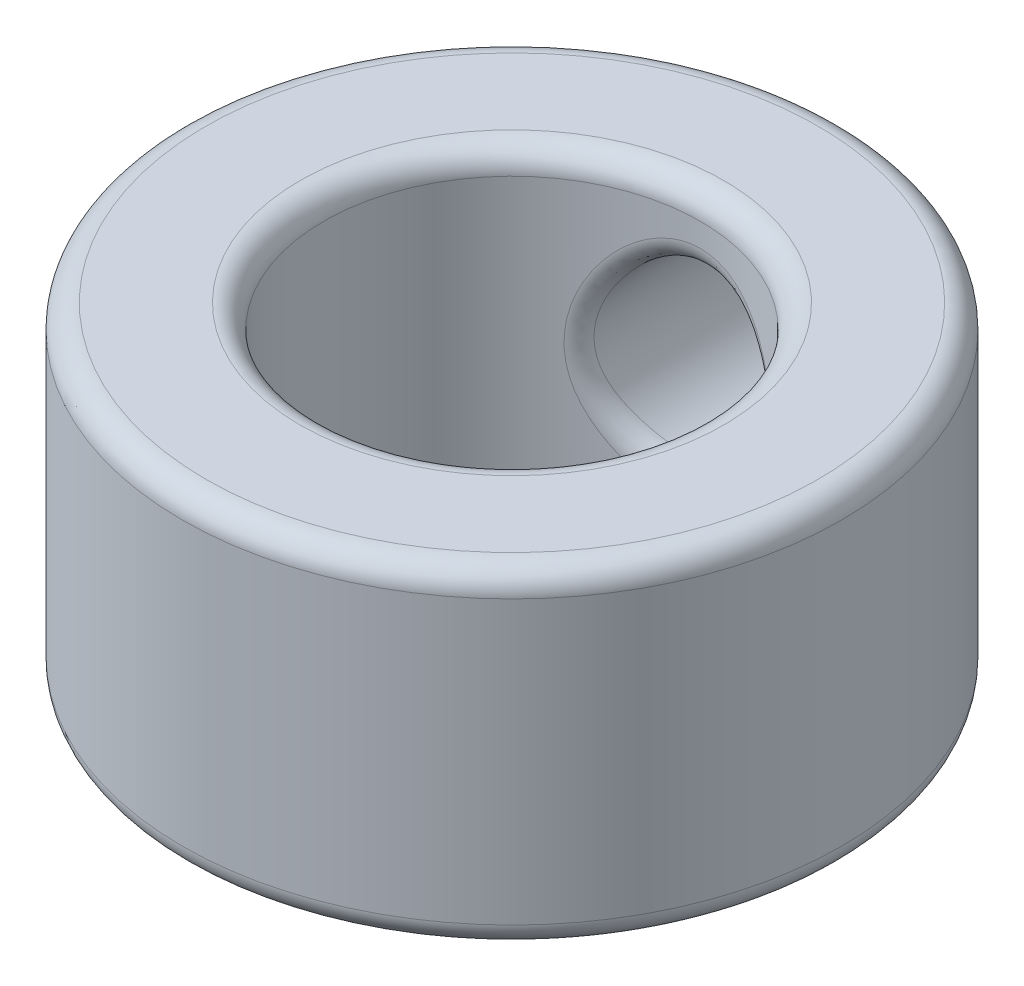
from build123d import *

# Parameters (mm, degrees)
SKETCH1_R               = 7
SKETCH1_R_2             = 4
BOSS_EXTRUDE1_DEPTH     = 7
CUT_EXTRUDE1_REACH      = 14.124
CUT_EXTRUDE1_END_RADIUS = 7
SKETCH2_R               = 2
FILLET1_R               = 0.5
FILLET2_R               = 0.5


with BuildPart() as part:
    # Sketch1 → Boss-Extrude1 (new body)
    with BuildSketch(Plane(origin=(0, 0, 0), x_dir=(1, 0, 0), z_dir=(0, 1, 0))):
        with Locations(Location((0, 0, 0), (0, 0, 270))):
            Circle(SKETCH1_R)
        with Locations(Location((0, 0, 0), (0, 0, 270))):
            Circle(SKETCH1_R_2, mode=Mode.SUBTRACT)
    extrude(amount=BOSS_EXTRUDE1_DEPTH)

    # Cut-Extrude1: up to this cylinder (the profile starts inside it)
    cut_extrude1_end = Plane(origin=(0, 3.5, 0), z_dir=(0, -1, 0)) * Cylinder(CUT_EXTRUDE1_END_RADIUS, 43.248, mode=Mode.PRIVATE)
    # Sketch2 → Cut-Extrude1 (cut, up to the surface)
    with BuildSketch(Plane.XY, mode=Mode.PRIVATE) as cut_extrude1_sk1:
        with Locations((0, 3.5)):
            Circle(SKETCH2_R)
    cut_extrude1_tool1 = extrude(cut_extrude1_sk1.sketch, amount=-CUT_EXTRUDE1_REACH, mode=Mode.PRIVATE) & cut_extrude1_end
    add(cut_extrude1_tool1.solids().sort_by_distance((0, 3.5, 0))[0], mode=Mode.SUBTRACT)

    # Fillet1
    fillet1_edges = [part.edges().sort_by_distance(p)[0] for p in [
        (0, 0, -7),
        (0, 7, -7),
    ]]
    fillet(fillet1_edges, radius=FILLET1_R)

    # Fillet2
    fillet2_edges = [part.edges().sort_by_distance(p)[0] for p in [
        (-2, 3.5, -3.464101615),
        (0, 0, -4),
        (0, 7, -4),
    ]]
    fillet(fillet2_edges, radius=FILLET2_R)


solid = part.part
